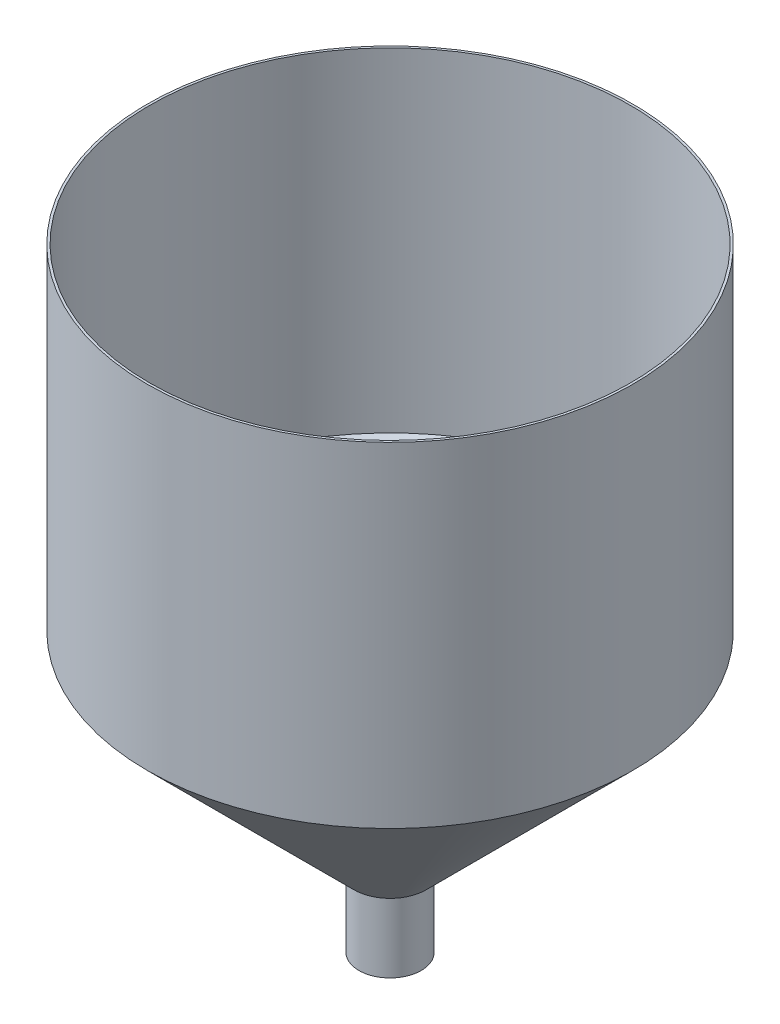
from build123d import *

# Parameters (mm, degrees)
CROQUIS1_R              = 334.8
SALIENTE_EXTRUIR1_DEPTH = 461.3
CROQUIS3_R              = 50
CROQUIS2_R              = 334.8
CROQUIS4_R              = 43
SALIENTE_EXTRUIR2_DEPTH = 100
VACIADO1_T              = -3.175


with BuildPart() as part:
    # Croquis1 → Saliente-Extruir1 (new body)
    with BuildSketch(Plane(origin=(0, 0, 0), x_dir=(1, 0, 0), z_dir=(0, 1, 0))):
        with Locations(Location((0, 0, 0), (0, 0, 270))):
            Circle(CROQUIS1_R)
    extrude(amount=-SALIENTE_EXTRUIR1_DEPTH)

    # Croquis3 → Recubrir1 section 0
    with BuildSketch(Plane(origin=(0, -746.1, 0), x_dir=(1, 0, 0), z_dir=(0, 1, 0))):
        Circle(CROQUIS3_R)
    # Croquis2 → Recubrir1 section 1
    with BuildSketch(Plane.XZ.offset(461.3)):
        Circle(CROQUIS2_R)
    loft()

    # Croquis4 → Saliente-Extruir2 (add)
    with BuildSketch(Plane.XZ.offset(746.1)):
        with Locations(Location((0, 0, 0), (0, 0, 270))):
            Circle(CROQUIS4_R)
    extrude(amount=SALIENTE_EXTRUIR2_DEPTH)

    # Vaciado1
    vaciado1_openings = [part.faces().sort_by_distance(p)[0] for p in [
        (0, -846.1, 0),
        (0, 0, 0),
    ]]
    offset(amount=VACIADO1_T, openings=vaciado1_openings, kind=Kind.INTERSECTION)


solid = part.part
